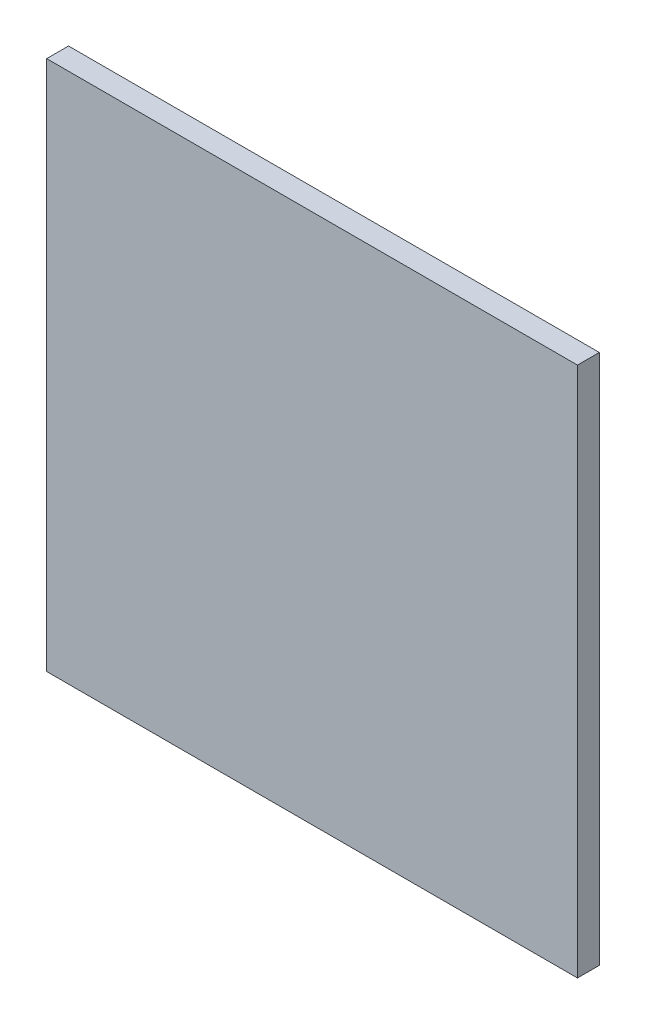
from build123d import *

# Parameters (mm, degrees)
SKETCH_1_W      = 340
SKETCH_1_H      = 340
EXTRUDE_1_DEPTH = 14


with BuildPart() as part:
    # Эскиз1 → Бобышка-Вытянуть1 (new body)
    with BuildSketch(Plane.XY):
        Rectangle(SKETCH_1_W, SKETCH_1_H)
    extrude(amount=EXTRUDE_1_DEPTH)


solid = part.part
